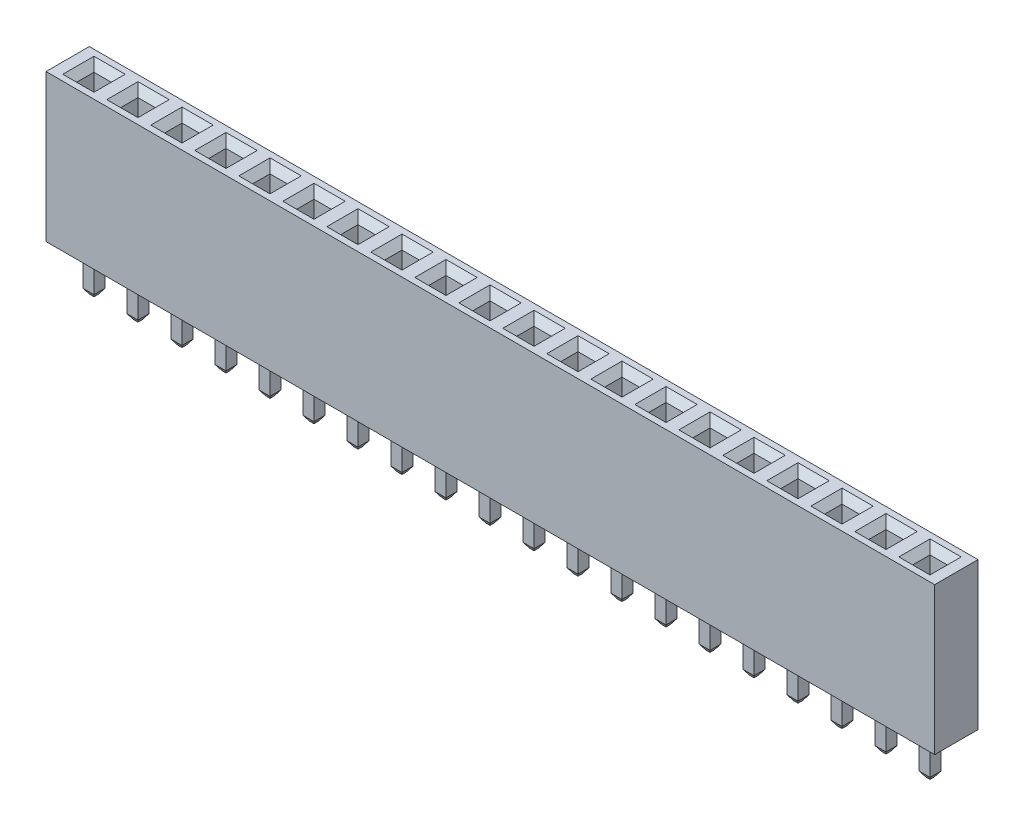
from build123d import *
from OCP.BRepFilletAPI import BRepFilletAPI_MakeChamfer

# Parameters (mm, degrees)
SKETCH1_W           = 51.3
SKETCH1_H           = 2.5
BOSS_EXTRUDE1_DEPTH = 8.5
SKETCH2_W           = 0.64
SKETCH2_H           = 0.64
BOSS_EXTRUDE2_DEPTH = 2.5
CHAMFER1_SIZE       = 0.3
CHAMFER1_SIZE2      = 0.194822278
SKETCH3_W           = 1
SKETCH3_H           = 1
CUT_EXTRUDE1_DEPTH  = 6
CHAMFER2_SIZE       = 0.4


with BuildPart() as part:
    # Sketch1 → Boss-Extrude1 (new body)
    with BuildSketch(Plane(origin=(0, 0, 0), x_dir=(1, 0, 0), z_dir=(0, 1, 0))):
        with Locations((25.65, 1.25)):
            Rectangle(SKETCH1_W, SKETCH1_H)
    extrude(amount=BOSS_EXTRUDE1_DEPTH)

    # Sketch2 → Boss-Extrude2 (add)
    with BuildSketch(Plane.XZ):
        with Locations((1.52, -1.25)):
            Rectangle(SKETCH2_W, SKETCH2_H)
        with Locations((4.06, -1.25)):
            Rectangle(SKETCH2_W, SKETCH2_H)
        with Locations((6.6, -1.25)):
            Rectangle(SKETCH2_W, SKETCH2_H)
        with Locations((9.14, -1.25)):
            Rectangle(SKETCH2_W, SKETCH2_H)
        with Locations((11.68, -1.25)):
            Rectangle(SKETCH2_W, SKETCH2_H)
        with Locations((14.22, -1.25)):
            Rectangle(SKETCH2_W, SKETCH2_H)
        with Locations((16.76, -1.25)):
            Rectangle(SKETCH2_W, SKETCH2_H)
        with Locations((19.3, -1.25)):
            Rectangle(SKETCH2_W, SKETCH2_H)
        with Locations((21.84, -1.25)):
            Rectangle(SKETCH2_W, SKETCH2_H)
        with Locations((24.38, -1.25)):
            Rectangle(SKETCH2_W, SKETCH2_H)
        with Locations((26.92, -1.25)):
            Rectangle(SKETCH2_W, SKETCH2_H)
        with Locations((29.46, -1.25)):
            Rectangle(SKETCH2_W, SKETCH2_H)
        with Locations((32, -1.25)):
            Rectangle(SKETCH2_W, SKETCH2_H)
        with Locations((34.54, -1.25)):
            Rectangle(SKETCH2_W, SKETCH2_H)
        with Locations((37.08, -1.25)):
            Rectangle(SKETCH2_W, SKETCH2_H)
        with Locations((39.62, -1.25)):
            Rectangle(SKETCH2_W, SKETCH2_H)
        with Locations((42.16, -1.25)):
            Rectangle(SKETCH2_W, SKETCH2_H)
        with Locations((44.7, -1.25)):
            Rectangle(SKETCH2_W, SKETCH2_H)
        with Locations((47.24, -1.25)):
            Rectangle(SKETCH2_W, SKETCH2_H)
        with Locations((49.78, -1.25)):
            Rectangle(SKETCH2_W, SKETCH2_H)
    extrude(amount=BOSS_EXTRUDE2_DEPTH)

    # Chamfer1: one chamfer whose edges measure the first distance from different faces: ONE call of the kernel's chamfer builder (chamfer() names one face for all edges)
    chamfer1_edges_1 = [part.edges().sort_by_distance(p)[0] for p in [
        (21.52, -2.5, -1.25),
    ]]
    chamfer1_side_1 = [part.faces().sort_by_distance(p)[0] for p in [
        (21.52, -1.25, -1.25),
    ]]
    chamfer1_edges_2 = [part.edges().sort_by_distance(p)[0] for p in [
        (21.84, -2.5, -1.57),
    ]]
    chamfer1_side_2 = [part.faces().sort_by_distance(p)[0] for p in [
        (21.84, -1.25, -1.57),
    ]]
    chamfer1_edges_3 = [part.edges().sort_by_distance(p)[0] for p in [
        (22.16, -2.5, -1.25),
    ]]
    chamfer1_side_3 = [part.faces().sort_by_distance(p)[0] for p in [
        (22.16, -1.25, -1.25),
    ]]
    chamfer1_edges_4 = [part.edges().sort_by_distance(p)[0] for p in [
        (21.84, -2.5, -0.93),
    ]]
    chamfer1_side_4 = [part.faces().sort_by_distance(p)[0] for p in [
        (21.84, -1.25, -0.93),
    ]]
    chamfer1_edges_5 = [part.edges().sort_by_distance(p)[0] for p in [
        (24.06, -2.5, -1.25),
    ]]
    chamfer1_side_5 = [part.faces().sort_by_distance(p)[0] for p in [
        (24.06, -1.25, -1.25),
    ]]
    chamfer1_edges_6 = [part.edges().sort_by_distance(p)[0] for p in [
        (24.38, -2.5, -1.57),
    ]]
    chamfer1_side_6 = [part.faces().sort_by_distance(p)[0] for p in [
        (24.38, -1.25, -1.57),
    ]]
    chamfer1_edges_7 = [part.edges().sort_by_distance(p)[0] for p in [
        (24.7, -2.5, -1.25),
    ]]
    chamfer1_side_7 = [part.faces().sort_by_distance(p)[0] for p in [
        (24.7, -1.25, -1.25),
    ]]
    chamfer1_edges_8 = [part.edges().sort_by_distance(p)[0] for p in [
        (24.38, -2.5, -0.93),
    ]]
    chamfer1_side_8 = [part.faces().sort_by_distance(p)[0] for p in [
        (24.38, -1.25, -0.93),
    ]]
    chamfer1_edges_9 = [part.edges().sort_by_distance(p)[0] for p in [
        (26.6, -2.5, -1.25),
    ]]
    chamfer1_side_9 = [part.faces().sort_by_distance(p)[0] for p in [
        (26.6, -1.25, -1.25),
    ]]
    chamfer1_edges_10 = [part.edges().sort_by_distance(p)[0] for p in [
        (26.92, -2.5, -1.57),
    ]]
    chamfer1_side_10 = [part.faces().sort_by_distance(p)[0] for p in [
        (26.92, -1.25, -1.57),
    ]]
    chamfer1_edges_11 = [part.edges().sort_by_distance(p)[0] for p in [
        (27.24, -2.5, -1.25),
    ]]
    chamfer1_side_11 = [part.faces().sort_by_distance(p)[0] for p in [
        (27.24, -1.25, -1.25),
    ]]
    chamfer1_edges_12 = [part.edges().sort_by_distance(p)[0] for p in [
        (26.92, -2.5, -0.93),
    ]]
    chamfer1_side_12 = [part.faces().sort_by_distance(p)[0] for p in [
        (26.92, -1.25, -0.93),
    ]]
    chamfer1_edges_13 = [part.edges().sort_by_distance(p)[0] for p in [
        (29.14, -2.5, -1.25),
    ]]
    chamfer1_side_13 = [part.faces().sort_by_distance(p)[0] for p in [
        (29.14, -1.25, -1.25),
    ]]
    chamfer1_edges_14 = [part.edges().sort_by_distance(p)[0] for p in [
        (29.46, -2.5, -1.57),
    ]]
    chamfer1_side_14 = [part.faces().sort_by_distance(p)[0] for p in [
        (29.46, -1.25, -1.57),
    ]]
    chamfer1_edges_15 = [part.edges().sort_by_distance(p)[0] for p in [
        (29.78, -2.5, -1.25),
    ]]
    chamfer1_side_15 = [part.faces().sort_by_distance(p)[0] for p in [
        (29.78, -1.25, -1.25),
    ]]
    chamfer1_edges_16 = [part.edges().sort_by_distance(p)[0] for p in [
        (29.46, -2.5, -0.93),
    ]]
    chamfer1_side_16 = [part.faces().sort_by_distance(p)[0] for p in [
        (29.46, -1.25, -0.93),
    ]]
    chamfer1_edges_17 = [part.edges().sort_by_distance(p)[0] for p in [
        (31.68, -2.5, -1.25),
    ]]
    chamfer1_side_17 = [part.faces().sort_by_distance(p)[0] for p in [
        (31.68, -1.25, -1.25),
    ]]
    chamfer1_edges_18 = [part.edges().sort_by_distance(p)[0] for p in [
        (32, -2.5, -1.57),
    ]]
    chamfer1_side_18 = [part.faces().sort_by_distance(p)[0] for p in [
        (32, -1.25, -1.57),
    ]]
    chamfer1_edges_19 = [part.edges().sort_by_distance(p)[0] for p in [
        (32.32, -2.5, -1.25),
    ]]
    chamfer1_side_19 = [part.faces().sort_by_distance(p)[0] for p in [
        (32.32, -1.25, -1.25),
    ]]
    chamfer1_edges_20 = [part.edges().sort_by_distance(p)[0] for p in [
        (32, -2.5, -0.93),
    ]]
    chamfer1_side_20 = [part.faces().sort_by_distance(p)[0] for p in [
        (32, -1.25, -0.93),
    ]]
    chamfer1_edges_21 = [part.edges().sort_by_distance(p)[0] for p in [
        (34.22, -2.5, -1.25),
    ]]
    chamfer1_side_21 = [part.faces().sort_by_distance(p)[0] for p in [
        (34.22, -1.25, -1.25),
    ]]
    chamfer1_edges_22 = [part.edges().sort_by_distance(p)[0] for p in [
        (34.54, -2.5, -1.57),
    ]]
    chamfer1_side_22 = [part.faces().sort_by_distance(p)[0] for p in [
        (34.54, -1.25, -1.57),
    ]]
    chamfer1_edges_23 = [part.edges().sort_by_distance(p)[0] for p in [
        (34.86, -2.5, -1.25),
    ]]
    chamfer1_side_23 = [part.faces().sort_by_distance(p)[0] for p in [
        (34.86, -1.25, -1.25),
    ]]
    chamfer1_edges_24 = [part.edges().sort_by_distance(p)[0] for p in [
        (34.54, -2.5, -0.93),
    ]]
    chamfer1_side_24 = [part.faces().sort_by_distance(p)[0] for p in [
        (34.54, -1.25, -0.93),
    ]]
    chamfer1_edges_25 = [part.edges().sort_by_distance(p)[0] for p in [
        (36.76, -2.5, -1.25),
    ]]
    chamfer1_side_25 = [part.faces().sort_by_distance(p)[0] for p in [
        (36.76, -1.25, -1.25),
    ]]
    chamfer1_edges_26 = [part.edges().sort_by_distance(p)[0] for p in [
        (37.08, -2.5, -1.57),
    ]]
    chamfer1_side_26 = [part.faces().sort_by_distance(p)[0] for p in [
        (37.08, -1.25, -1.57),
    ]]
    chamfer1_edges_27 = [part.edges().sort_by_distance(p)[0] for p in [
        (37.4, -2.5, -1.25),
    ]]
    chamfer1_side_27 = [part.faces().sort_by_distance(p)[0] for p in [
        (37.4, -1.25, -1.25),
    ]]
    chamfer1_edges_28 = [part.edges().sort_by_distance(p)[0] for p in [
        (37.08, -2.5, -0.93),
    ]]
    chamfer1_side_28 = [part.faces().sort_by_distance(p)[0] for p in [
        (37.08, -1.25, -0.93),
    ]]
    chamfer1_edges_29 = [part.edges().sort_by_distance(p)[0] for p in [
        (1.2, -2.5, -1.25),
    ]]
    chamfer1_side_29 = [part.faces().sort_by_distance(p)[0] for p in [
        (1.2, -1.25, -1.25),
    ]]
    chamfer1_edges_30 = [part.edges().sort_by_distance(p)[0] for p in [
        (1.52, -2.5, -1.57),
    ]]
    chamfer1_side_30 = [part.faces().sort_by_distance(p)[0] for p in [
        (1.52, -1.25, -1.57),
    ]]
    chamfer1_edges_31 = [part.edges().sort_by_distance(p)[0] for p in [
        (1.84, -2.5, -1.25),
    ]]
    chamfer1_side_31 = [part.faces().sort_by_distance(p)[0] for p in [
        (1.84, -1.25, -1.25),
    ]]
    chamfer1_edges_32 = [part.edges().sort_by_distance(p)[0] for p in [
        (39.3, -2.5, -1.25),
    ]]
    chamfer1_side_32 = [part.faces().sort_by_distance(p)[0] for p in [
        (39.3, -1.25, -1.25),
    ]]
    chamfer1_edges_33 = [part.edges().sort_by_distance(p)[0] for p in [
        (39.62, -2.5, -1.57),
    ]]
    chamfer1_side_33 = [part.faces().sort_by_distance(p)[0] for p in [
        (39.62, -1.25, -1.57),
    ]]
    chamfer1_edges_34 = [part.edges().sort_by_distance(p)[0] for p in [
        (39.94, -2.5, -1.25),
    ]]
    chamfer1_side_34 = [part.faces().sort_by_distance(p)[0] for p in [
        (39.94, -1.25, -1.25),
    ]]
    chamfer1_edges_35 = [part.edges().sort_by_distance(p)[0] for p in [
        (39.62, -2.5, -0.93),
    ]]
    chamfer1_side_35 = [part.faces().sort_by_distance(p)[0] for p in [
        (39.62, -1.25, -0.93),
    ]]
    chamfer1_edges_36 = [part.edges().sort_by_distance(p)[0] for p in [
        (1.52, -2.5, -0.93),
    ]]
    chamfer1_side_36 = [part.faces().sort_by_distance(p)[0] for p in [
        (1.52, -1.25, -0.93),
    ]]
    chamfer1_edges_37 = [part.edges().sort_by_distance(p)[0] for p in [
        (41.84, -2.5, -1.25),
    ]]
    chamfer1_side_37 = [part.faces().sort_by_distance(p)[0] for p in [
        (41.84, -1.25, -1.25),
    ]]
    chamfer1_edges_38 = [part.edges().sort_by_distance(p)[0] for p in [
        (42.16, -2.5, -1.57),
    ]]
    chamfer1_side_38 = [part.faces().sort_by_distance(p)[0] for p in [
        (42.16, -1.25, -1.57),
    ]]
    chamfer1_edges_39 = [part.edges().sort_by_distance(p)[0] for p in [
        (42.48, -2.5, -1.25),
    ]]
    chamfer1_side_39 = [part.faces().sort_by_distance(p)[0] for p in [
        (42.48, -1.25, -1.25),
    ]]
    chamfer1_edges_40 = [part.edges().sort_by_distance(p)[0] for p in [
        (42.16, -2.5, -0.93),
    ]]
    chamfer1_side_40 = [part.faces().sort_by_distance(p)[0] for p in [
        (42.16, -1.25, -0.93),
    ]]
    chamfer1_edges_41 = [part.edges().sort_by_distance(p)[0] for p in [
        (44.38, -2.5, -1.25),
    ]]
    chamfer1_side_41 = [part.faces().sort_by_distance(p)[0] for p in [
        (44.38, -1.25, -1.25),
    ]]
    chamfer1_edges_42 = [part.edges().sort_by_distance(p)[0] for p in [
        (44.7, -2.5, -1.57),
    ]]
    chamfer1_side_42 = [part.faces().sort_by_distance(p)[0] for p in [
        (44.7, -1.25, -1.57),
    ]]
    chamfer1_edges_43 = [part.edges().sort_by_distance(p)[0] for p in [
        (45.02, -2.5, -1.25),
    ]]
    chamfer1_side_43 = [part.faces().sort_by_distance(p)[0] for p in [
        (45.02, -1.25, -1.25),
    ]]
    chamfer1_edges_44 = [part.edges().sort_by_distance(p)[0] for p in [
        (44.7, -2.5, -0.93),
    ]]
    chamfer1_side_44 = [part.faces().sort_by_distance(p)[0] for p in [
        (44.7, -1.25, -0.93),
    ]]
    chamfer1_edges_45 = [part.edges().sort_by_distance(p)[0] for p in [
        (46.92, -2.5, -1.25),
    ]]
    chamfer1_side_45 = [part.faces().sort_by_distance(p)[0] for p in [
        (46.92, -1.25, -1.25),
    ]]
    chamfer1_edges_46 = [part.edges().sort_by_distance(p)[0] for p in [
        (47.24, -2.5, -1.57),
    ]]
    chamfer1_side_46 = [part.faces().sort_by_distance(p)[0] for p in [
        (47.24, -1.25, -1.57),
    ]]
    chamfer1_edges_47 = [part.edges().sort_by_distance(p)[0] for p in [
        (47.56, -2.5, -1.25),
    ]]
    chamfer1_side_47 = [part.faces().sort_by_distance(p)[0] for p in [
        (47.56, -1.25, -1.25),
    ]]
    chamfer1_edges_48 = [part.edges().sort_by_distance(p)[0] for p in [
        (47.24, -2.5, -0.93),
    ]]
    chamfer1_side_48 = [part.faces().sort_by_distance(p)[0] for p in [
        (47.24, -1.25, -0.93),
    ]]
    chamfer1_edges_49 = [part.edges().sort_by_distance(p)[0] for p in [
        (49.46, -2.5, -1.25),
    ]]
    chamfer1_side_49 = [part.faces().sort_by_distance(p)[0] for p in [
        (49.46, -1.25, -1.25),
    ]]
    chamfer1_edges_50 = [part.edges().sort_by_distance(p)[0] for p in [
        (49.78, -2.5, -1.57),
    ]]
    chamfer1_side_50 = [part.faces().sort_by_distance(p)[0] for p in [
        (49.78, -1.25, -1.57),
    ]]
    chamfer1_edges_51 = [part.edges().sort_by_distance(p)[0] for p in [
        (50.1, -2.5, -1.25),
    ]]
    chamfer1_side_51 = [part.faces().sort_by_distance(p)[0] for p in [
        (50.1, -1.25, -1.25),
    ]]
    chamfer1_edges_52 = [part.edges().sort_by_distance(p)[0] for p in [
        (49.78, -2.5, -0.93),
    ]]
    chamfer1_side_52 = [part.faces().sort_by_distance(p)[0] for p in [
        (49.78, -1.25, -0.93),
    ]]
    chamfer1_edges_53 = [part.edges().sort_by_distance(p)[0] for p in [
        (3.74, -2.5, -1.25),
    ]]
    chamfer1_side_53 = [part.faces().sort_by_distance(p)[0] for p in [
        (3.74, -1.25, -1.25),
    ]]
    chamfer1_edges_54 = [part.edges().sort_by_distance(p)[0] for p in [
        (4.06, -2.5, -1.57),
    ]]
    chamfer1_side_54 = [part.faces().sort_by_distance(p)[0] for p in [
        (4.06, -1.25, -1.57),
    ]]
    chamfer1_edges_55 = [part.edges().sort_by_distance(p)[0] for p in [
        (4.38, -2.5, -1.25),
    ]]
    chamfer1_side_55 = [part.faces().sort_by_distance(p)[0] for p in [
        (4.38, -1.25, -1.25),
    ]]
    chamfer1_edges_56 = [part.edges().sort_by_distance(p)[0] for p in [
        (4.06, -2.5, -0.93),
    ]]
    chamfer1_side_56 = [part.faces().sort_by_distance(p)[0] for p in [
        (4.06, -1.25, -0.93),
    ]]
    chamfer1_edges_57 = [part.edges().sort_by_distance(p)[0] for p in [
        (6.28, -2.5, -1.25),
    ]]
    chamfer1_side_57 = [part.faces().sort_by_distance(p)[0] for p in [
        (6.28, -1.25, -1.25),
    ]]
    chamfer1_edges_58 = [part.edges().sort_by_distance(p)[0] for p in [
        (6.6, -2.5, -1.57),
    ]]
    chamfer1_side_58 = [part.faces().sort_by_distance(p)[0] for p in [
        (6.6, -1.25, -1.57),
    ]]
    chamfer1_edges_59 = [part.edges().sort_by_distance(p)[0] for p in [
        (6.92, -2.5, -1.25),
    ]]
    chamfer1_side_59 = [part.faces().sort_by_distance(p)[0] for p in [
        (6.92, -1.25, -1.25),
    ]]
    chamfer1_edges_60 = [part.edges().sort_by_distance(p)[0] for p in [
        (6.6, -2.5, -0.93),
    ]]
    chamfer1_side_60 = [part.faces().sort_by_distance(p)[0] for p in [
        (6.6, -1.25, -0.93),
    ]]
    chamfer1_edges_61 = [part.edges().sort_by_distance(p)[0] for p in [
        (8.82, -2.5, -1.25),
    ]]
    chamfer1_side_61 = [part.faces().sort_by_distance(p)[0] for p in [
        (8.82, -1.25, -1.25),
    ]]
    chamfer1_edges_62 = [part.edges().sort_by_distance(p)[0] for p in [
        (9.14, -2.5, -1.57),
    ]]
    chamfer1_side_62 = [part.faces().sort_by_distance(p)[0] for p in [
        (9.14, -1.25, -1.57),
    ]]
    chamfer1_edges_63 = [part.edges().sort_by_distance(p)[0] for p in [
        (9.46, -2.5, -1.25),
    ]]
    chamfer1_side_63 = [part.faces().sort_by_distance(p)[0] for p in [
        (9.46, -1.25, -1.25),
    ]]
    chamfer1_edges_64 = [part.edges().sort_by_distance(p)[0] for p in [
        (9.14, -2.5, -0.93),
    ]]
    chamfer1_side_64 = [part.faces().sort_by_distance(p)[0] for p in [
        (9.14, -1.25, -0.93),
    ]]
    chamfer1_edges_65 = [part.edges().sort_by_distance(p)[0] for p in [
        (11.36, -2.5, -1.25),
    ]]
    chamfer1_side_65 = [part.faces().sort_by_distance(p)[0] for p in [
        (11.36, -1.25, -1.25),
    ]]
    chamfer1_edges_66 = [part.edges().sort_by_distance(p)[0] for p in [
        (11.68, -2.5, -1.57),
    ]]
    chamfer1_side_66 = [part.faces().sort_by_distance(p)[0] for p in [
        (11.68, -1.25, -1.57),
    ]]
    chamfer1_edges_67 = [part.edges().sort_by_distance(p)[0] for p in [
        (12, -2.5, -1.25),
    ]]
    chamfer1_side_67 = [part.faces().sort_by_distance(p)[0] for p in [
        (12, -1.25, -1.25),
    ]]
    chamfer1_edges_68 = [part.edges().sort_by_distance(p)[0] for p in [
        (11.68, -2.5, -0.93),
    ]]
    chamfer1_side_68 = [part.faces().sort_by_distance(p)[0] for p in [
        (11.68, -1.25, -0.93),
    ]]
    chamfer1_edges_69 = [part.edges().sort_by_distance(p)[0] for p in [
        (13.9, -2.5, -1.25),
    ]]
    chamfer1_side_69 = [part.faces().sort_by_distance(p)[0] for p in [
        (13.9, -1.25, -1.25),
    ]]
    chamfer1_edges_70 = [part.edges().sort_by_distance(p)[0] for p in [
        (14.22, -2.5, -1.57),
    ]]
    chamfer1_side_70 = [part.faces().sort_by_distance(p)[0] for p in [
        (14.22, -1.25, -1.57),
    ]]
    chamfer1_edges_71 = [part.edges().sort_by_distance(p)[0] for p in [
        (14.54, -2.5, -1.25),
    ]]
    chamfer1_side_71 = [part.faces().sort_by_distance(p)[0] for p in [
        (14.54, -1.25, -1.25),
    ]]
    chamfer1_edges_72 = [part.edges().sort_by_distance(p)[0] for p in [
        (14.22, -2.5, -0.93),
    ]]
    chamfer1_side_72 = [part.faces().sort_by_distance(p)[0] for p in [
        (14.22, -1.25, -0.93),
    ]]
    chamfer1_edges_73 = [part.edges().sort_by_distance(p)[0] for p in [
        (16.44, -2.5, -1.25),
    ]]
    chamfer1_side_73 = [part.faces().sort_by_distance(p)[0] for p in [
        (16.44, -1.25, -1.25),
    ]]
    chamfer1_edges_74 = [part.edges().sort_by_distance(p)[0] for p in [
        (16.76, -2.5, -1.57),
    ]]
    chamfer1_side_74 = [part.faces().sort_by_distance(p)[0] for p in [
        (16.76, -1.25, -1.57),
    ]]
    chamfer1_edges_75 = [part.edges().sort_by_distance(p)[0] for p in [
        (17.08, -2.5, -1.25),
    ]]
    chamfer1_side_75 = [part.faces().sort_by_distance(p)[0] for p in [
        (17.08, -1.25, -1.25),
    ]]
    chamfer1_edges_76 = [part.edges().sort_by_distance(p)[0] for p in [
        (16.76, -2.5, -0.93),
    ]]
    chamfer1_side_76 = [part.faces().sort_by_distance(p)[0] for p in [
        (16.76, -1.25, -0.93),
    ]]
    chamfer1_edges_77 = [part.edges().sort_by_distance(p)[0] for p in [
        (18.98, -2.5, -1.25),
    ]]
    chamfer1_side_77 = [part.faces().sort_by_distance(p)[0] for p in [
        (18.98, -1.25, -1.25),
    ]]
    chamfer1_edges_78 = [part.edges().sort_by_distance(p)[0] for p in [
        (19.3, -2.5, -1.57),
    ]]
    chamfer1_side_78 = [part.faces().sort_by_distance(p)[0] for p in [
        (19.3, -1.25, -1.57),
    ]]
    chamfer1_edges_79 = [part.edges().sort_by_distance(p)[0] for p in [
        (19.62, -2.5, -1.25),
    ]]
    chamfer1_side_79 = [part.faces().sort_by_distance(p)[0] for p in [
        (19.62, -1.25, -1.25),
    ]]
    chamfer1_edges_80 = [part.edges().sort_by_distance(p)[0] for p in [
        (19.3, -2.5, -0.93),
    ]]
    chamfer1_side_80 = [part.faces().sort_by_distance(p)[0] for p in [
        (19.3, -1.25, -0.93),
    ]]
    chamfer1 = BRepFilletAPI_MakeChamfer(part.part.solid().wrapped)
    for e in chamfer1_edges_1:
        chamfer1.Add(CHAMFER1_SIZE, CHAMFER1_SIZE2, e.wrapped, chamfer1_side_1[0].wrapped)  # the first distance lies on this face
    for e in chamfer1_edges_2:
        chamfer1.Add(CHAMFER1_SIZE, CHAMFER1_SIZE2, e.wrapped, chamfer1_side_2[0].wrapped)  # the first distance lies on this face
    for e in chamfer1_edges_3:
        chamfer1.Add(CHAMFER1_SIZE, CHAMFER1_SIZE2, e.wrapped, chamfer1_side_3[0].wrapped)  # the first distance lies on this face
    for e in chamfer1_edges_4:
        chamfer1.Add(CHAMFER1_SIZE, CHAMFER1_SIZE2, e.wrapped, chamfer1_side_4[0].wrapped)  # the first distance lies on this face
    for e in chamfer1_edges_5:
        chamfer1.Add(CHAMFER1_SIZE, CHAMFER1_SIZE2, e.wrapped, chamfer1_side_5[0].wrapped)  # the first distance lies on this face
    for e in chamfer1_edges_6:
        chamfer1.Add(CHAMFER1_SIZE, CHAMFER1_SIZE2, e.wrapped, chamfer1_side_6[0].wrapped)  # the first distance lies on this face
    for e in chamfer1_edges_7:
        chamfer1.Add(CHAMFER1_SIZE, CHAMFER1_SIZE2, e.wrapped, chamfer1_side_7[0].wrapped)  # the first distance lies on this face
    for e in chamfer1_edges_8:
        chamfer1.Add(CHAMFER1_SIZE, CHAMFER1_SIZE2, e.wrapped, chamfer1_side_8[0].wrapped)  # the first distance lies on this face
    for e in chamfer1_edges_9:
        chamfer1.Add(CHAMFER1_SIZE, CHAMFER1_SIZE2, e.wrapped, chamfer1_side_9[0].wrapped)  # the first distance lies on this face
    for e in chamfer1_edges_10:
        chamfer1.Add(CHAMFER1_SIZE, CHAMFER1_SIZE2, e.wrapped, chamfer1_side_10[0].wrapped)  # the first distance lies on this face
    for e in chamfer1_edges_11:
        chamfer1.Add(CHAMFER1_SIZE, CHAMFER1_SIZE2, e.wrapped, chamfer1_side_11[0].wrapped)  # the first distance lies on this face
    for e in chamfer1_edges_12:
        chamfer1.Add(CHAMFER1_SIZE, CHAMFER1_SIZE2, e.wrapped, chamfer1_side_12[0].wrapped)  # the first distance lies on this face
    for e in chamfer1_edges_13:
        chamfer1.Add(CHAMFER1_SIZE, CHAMFER1_SIZE2, e.wrapped, chamfer1_side_13[0].wrapped)  # the first distance lies on this face
    for e in chamfer1_edges_14:
        chamfer1.Add(CHAMFER1_SIZE, CHAMFER1_SIZE2, e.wrapped, chamfer1_side_14[0].wrapped)  # the first distance lies on this face
    for e in chamfer1_edges_15:
        chamfer1.Add(CHAMFER1_SIZE, CHAMFER1_SIZE2, e.wrapped, chamfer1_side_15[0].wrapped)  # the first distance lies on this face
    for e in chamfer1_edges_16:
        chamfer1.Add(CHAMFER1_SIZE, CHAMFER1_SIZE2, e.wrapped, chamfer1_side_16[0].wrapped)  # the first distance lies on this face
    for e in chamfer1_edges_17:
        chamfer1.Add(CHAMFER1_SIZE, CHAMFER1_SIZE2, e.wrapped, chamfer1_side_17[0].wrapped)  # the first distance lies on this face
    for e in chamfer1_edges_18:
        chamfer1.Add(CHAMFER1_SIZE, CHAMFER1_SIZE2, e.wrapped, chamfer1_side_18[0].wrapped)  # the first distance lies on this face
    for e in chamfer1_edges_19:
        chamfer1.Add(CHAMFER1_SIZE, CHAMFER1_SIZE2, e.wrapped, chamfer1_side_19[0].wrapped)  # the first distance lies on this face
    for e in chamfer1_edges_20:
        chamfer1.Add(CHAMFER1_SIZE, CHAMFER1_SIZE2, e.wrapped, chamfer1_side_20[0].wrapped)  # the first distance lies on this face
    for e in chamfer1_edges_21:
        chamfer1.Add(CHAMFER1_SIZE, CHAMFER1_SIZE2, e.wrapped, chamfer1_side_21[0].wrapped)  # the first distance lies on this face
    for e in chamfer1_edges_22:
        chamfer1.Add(CHAMFER1_SIZE, CHAMFER1_SIZE2, e.wrapped, chamfer1_side_22[0].wrapped)  # the first distance lies on this face
    for e in chamfer1_edges_23:
        chamfer1.Add(CHAMFER1_SIZE, CHAMFER1_SIZE2, e.wrapped, chamfer1_side_23[0].wrapped)  # the first distance lies on this face
    for e in chamfer1_edges_24:
        chamfer1.Add(CHAMFER1_SIZE, CHAMFER1_SIZE2, e.wrapped, chamfer1_side_24[0].wrapped)  # the first distance lies on this face
    for e in chamfer1_edges_25:
        chamfer1.Add(CHAMFER1_SIZE, CHAMFER1_SIZE2, e.wrapped, chamfer1_side_25[0].wrapped)  # the first distance lies on this face
    for e in chamfer1_edges_26:
        chamfer1.Add(CHAMFER1_SIZE, CHAMFER1_SIZE2, e.wrapped, chamfer1_side_26[0].wrapped)  # the first distance lies on this face
    for e in chamfer1_edges_27:
        chamfer1.Add(CHAMFER1_SIZE, CHAMFER1_SIZE2, e.wrapped, chamfer1_side_27[0].wrapped)  # the first distance lies on this face
    for e in chamfer1_edges_28:
        chamfer1.Add(CHAMFER1_SIZE, CHAMFER1_SIZE2, e.wrapped, chamfer1_side_28[0].wrapped)  # the first distance lies on this face
    for e in chamfer1_edges_29:
        chamfer1.Add(CHAMFER1_SIZE, CHAMFER1_SIZE2, e.wrapped, chamfer1_side_29[0].wrapped)  # the first distance lies on this face
    for e in chamfer1_edges_30:
        chamfer1.Add(CHAMFER1_SIZE, CHAMFER1_SIZE2, e.wrapped, chamfer1_side_30[0].wrapped)  # the first distance lies on this face
    for e in chamfer1_edges_31:
        chamfer1.Add(CHAMFER1_SIZE, CHAMFER1_SIZE2, e.wrapped, chamfer1_side_31[0].wrapped)  # the first distance lies on this face
    for e in chamfer1_edges_32:
        chamfer1.Add(CHAMFER1_SIZE, CHAMFER1_SIZE2, e.wrapped, chamfer1_side_32[0].wrapped)  # the first distance lies on this face
    for e in chamfer1_edges_33:
        chamfer1.Add(CHAMFER1_SIZE, CHAMFER1_SIZE2, e.wrapped, chamfer1_side_33[0].wrapped)  # the first distance lies on this face
    for e in chamfer1_edges_34:
        chamfer1.Add(CHAMFER1_SIZE, CHAMFER1_SIZE2, e.wrapped, chamfer1_side_34[0].wrapped)  # the first distance lies on this face
    for e in chamfer1_edges_35:
        chamfer1.Add(CHAMFER1_SIZE, CHAMFER1_SIZE2, e.wrapped, chamfer1_side_35[0].wrapped)  # the first distance lies on this face
    for e in chamfer1_edges_36:
        chamfer1.Add(CHAMFER1_SIZE, CHAMFER1_SIZE2, e.wrapped, chamfer1_side_36[0].wrapped)  # the first distance lies on this face
    for e in chamfer1_edges_37:
        chamfer1.Add(CHAMFER1_SIZE, CHAMFER1_SIZE2, e.wrapped, chamfer1_side_37[0].wrapped)  # the first distance lies on this face
    for e in chamfer1_edges_38:
        chamfer1.Add(CHAMFER1_SIZE, CHAMFER1_SIZE2, e.wrapped, chamfer1_side_38[0].wrapped)  # the first distance lies on this face
    for e in chamfer1_edges_39:
        chamfer1.Add(CHAMFER1_SIZE, CHAMFER1_SIZE2, e.wrapped, chamfer1_side_39[0].wrapped)  # the first distance lies on this face
    for e in chamfer1_edges_40:
        chamfer1.Add(CHAMFER1_SIZE, CHAMFER1_SIZE2, e.wrapped, chamfer1_side_40[0].wrapped)  # the first distance lies on this face
    for e in chamfer1_edges_41:
        chamfer1.Add(CHAMFER1_SIZE, CHAMFER1_SIZE2, e.wrapped, chamfer1_side_41[0].wrapped)  # the first distance lies on this face
    for e in chamfer1_edges_42:
        chamfer1.Add(CHAMFER1_SIZE, CHAMFER1_SIZE2, e.wrapped, chamfer1_side_42[0].wrapped)  # the first distance lies on this face
    for e in chamfer1_edges_43:
        chamfer1.Add(CHAMFER1_SIZE, CHAMFER1_SIZE2, e.wrapped, chamfer1_side_43[0].wrapped)  # the first distance lies on this face
    for e in chamfer1_edges_44:
        chamfer1.Add(CHAMFER1_SIZE, CHAMFER1_SIZE2, e.wrapped, chamfer1_side_44[0].wrapped)  # the first distance lies on this face
    for e in chamfer1_edges_45:
        chamfer1.Add(CHAMFER1_SIZE, CHAMFER1_SIZE2, e.wrapped, chamfer1_side_45[0].wrapped)  # the first distance lies on this face
    for e in chamfer1_edges_46:
        chamfer1.Add(CHAMFER1_SIZE, CHAMFER1_SIZE2, e.wrapped, chamfer1_side_46[0].wrapped)  # the first distance lies on this face
    for e in chamfer1_edges_47:
        chamfer1.Add(CHAMFER1_SIZE, CHAMFER1_SIZE2, e.wrapped, chamfer1_side_47[0].wrapped)  # the first distance lies on this face
    for e in chamfer1_edges_48:
        chamfer1.Add(CHAMFER1_SIZE, CHAMFER1_SIZE2, e.wrapped, chamfer1_side_48[0].wrapped)  # the first distance lies on this face
    for e in chamfer1_edges_49:
        chamfer1.Add(CHAMFER1_SIZE, CHAMFER1_SIZE2, e.wrapped, chamfer1_side_49[0].wrapped)  # the first distance lies on this face
    for e in chamfer1_edges_50:
        chamfer1.Add(CHAMFER1_SIZE, CHAMFER1_SIZE2, e.wrapped, chamfer1_side_50[0].wrapped)  # the first distance lies on this face
    for e in chamfer1_edges_51:
        chamfer1.Add(CHAMFER1_SIZE, CHAMFER1_SIZE2, e.wrapped, chamfer1_side_51[0].wrapped)  # the first distance lies on this face
    for e in chamfer1_edges_52:
        chamfer1.Add(CHAMFER1_SIZE, CHAMFER1_SIZE2, e.wrapped, chamfer1_side_52[0].wrapped)  # the first distance lies on this face
    for e in chamfer1_edges_53:
        chamfer1.Add(CHAMFER1_SIZE, CHAMFER1_SIZE2, e.wrapped, chamfer1_side_53[0].wrapped)  # the first distance lies on this face
    for e in chamfer1_edges_54:
        chamfer1.Add(CHAMFER1_SIZE, CHAMFER1_SIZE2, e.wrapped, chamfer1_side_54[0].wrapped)  # the first distance lies on this face
    for e in chamfer1_edges_55:
        chamfer1.Add(CHAMFER1_SIZE, CHAMFER1_SIZE2, e.wrapped, chamfer1_side_55[0].wrapped)  # the first distance lies on this face
    for e in chamfer1_edges_56:
        chamfer1.Add(CHAMFER1_SIZE, CHAMFER1_SIZE2, e.wrapped, chamfer1_side_56[0].wrapped)  # the first distance lies on this face
    for e in chamfer1_edges_57:
        chamfer1.Add(CHAMFER1_SIZE, CHAMFER1_SIZE2, e.wrapped, chamfer1_side_57[0].wrapped)  # the first distance lies on this face
    for e in chamfer1_edges_58:
        chamfer1.Add(CHAMFER1_SIZE, CHAMFER1_SIZE2, e.wrapped, chamfer1_side_58[0].wrapped)  # the first distance lies on this face
    for e in chamfer1_edges_59:
        chamfer1.Add(CHAMFER1_SIZE, CHAMFER1_SIZE2, e.wrapped, chamfer1_side_59[0].wrapped)  # the first distance lies on this face
    for e in chamfer1_edges_60:
        chamfer1.Add(CHAMFER1_SIZE, CHAMFER1_SIZE2, e.wrapped, chamfer1_side_60[0].wrapped)  # the first distance lies on this face
    for e in chamfer1_edges_61:
        chamfer1.Add(CHAMFER1_SIZE, CHAMFER1_SIZE2, e.wrapped, chamfer1_side_61[0].wrapped)  # the first distance lies on this face
    for e in chamfer1_edges_62:
        chamfer1.Add(CHAMFER1_SIZE, CHAMFER1_SIZE2, e.wrapped, chamfer1_side_62[0].wrapped)  # the first distance lies on this face
    for e in chamfer1_edges_63:
        chamfer1.Add(CHAMFER1_SIZE, CHAMFER1_SIZE2, e.wrapped, chamfer1_side_63[0].wrapped)  # the first distance lies on this face
    for e in chamfer1_edges_64:
        chamfer1.Add(CHAMFER1_SIZE, CHAMFER1_SIZE2, e.wrapped, chamfer1_side_64[0].wrapped)  # the first distance lies on this face
    for e in chamfer1_edges_65:
        chamfer1.Add(CHAMFER1_SIZE, CHAMFER1_SIZE2, e.wrapped, chamfer1_side_65[0].wrapped)  # the first distance lies on this face
    for e in chamfer1_edges_66:
        chamfer1.Add(CHAMFER1_SIZE, CHAMFER1_SIZE2, e.wrapped, chamfer1_side_66[0].wrapped)  # the first distance lies on this face
    for e in chamfer1_edges_67:
        chamfer1.Add(CHAMFER1_SIZE, CHAMFER1_SIZE2, e.wrapped, chamfer1_side_67[0].wrapped)  # the first distance lies on this face
    for e in chamfer1_edges_68:
        chamfer1.Add(CHAMFER1_SIZE, CHAMFER1_SIZE2, e.wrapped, chamfer1_side_68[0].wrapped)  # the first distance lies on this face
    for e in chamfer1_edges_69:
        chamfer1.Add(CHAMFER1_SIZE, CHAMFER1_SIZE2, e.wrapped, chamfer1_side_69[0].wrapped)  # the first distance lies on this face
    for e in chamfer1_edges_70:
        chamfer1.Add(CHAMFER1_SIZE, CHAMFER1_SIZE2, e.wrapped, chamfer1_side_70[0].wrapped)  # the first distance lies on this face
    for e in chamfer1_edges_71:
        chamfer1.Add(CHAMFER1_SIZE, CHAMFER1_SIZE2, e.wrapped, chamfer1_side_71[0].wrapped)  # the first distance lies on this face
    for e in chamfer1_edges_72:
        chamfer1.Add(CHAMFER1_SIZE, CHAMFER1_SIZE2, e.wrapped, chamfer1_side_72[0].wrapped)  # the first distance lies on this face
    for e in chamfer1_edges_73:
        chamfer1.Add(CHAMFER1_SIZE, CHAMFER1_SIZE2, e.wrapped, chamfer1_side_73[0].wrapped)  # the first distance lies on this face
    for e in chamfer1_edges_74:
        chamfer1.Add(CHAMFER1_SIZE, CHAMFER1_SIZE2, e.wrapped, chamfer1_side_74[0].wrapped)  # the first distance lies on this face
    for e in chamfer1_edges_75:
        chamfer1.Add(CHAMFER1_SIZE, CHAMFER1_SIZE2, e.wrapped, chamfer1_side_75[0].wrapped)  # the first distance lies on this face
    for e in chamfer1_edges_76:
        chamfer1.Add(CHAMFER1_SIZE, CHAMFER1_SIZE2, e.wrapped, chamfer1_side_76[0].wrapped)  # the first distance lies on this face
    for e in chamfer1_edges_77:
        chamfer1.Add(CHAMFER1_SIZE, CHAMFER1_SIZE2, e.wrapped, chamfer1_side_77[0].wrapped)  # the first distance lies on this face
    for e in chamfer1_edges_78:
        chamfer1.Add(CHAMFER1_SIZE, CHAMFER1_SIZE2, e.wrapped, chamfer1_side_78[0].wrapped)  # the first distance lies on this face
    for e in chamfer1_edges_79:
        chamfer1.Add(CHAMFER1_SIZE, CHAMFER1_SIZE2, e.wrapped, chamfer1_side_79[0].wrapped)  # the first distance lies on this face
    for e in chamfer1_edges_80:
        chamfer1.Add(CHAMFER1_SIZE, CHAMFER1_SIZE2, e.wrapped, chamfer1_side_80[0].wrapped)  # the first distance lies on this face
    add(Compound.cast(chamfer1.Shape()), mode=Mode.REPLACE)

    # Sketch3 → Cut-Extrude1 (cut)
    with BuildSketch(Plane(origin=(0, 8.5, 0), x_dir=(1, 0, 0), z_dir=(0, 1, 0))):
        with Locations((49.78, 1.25)):
            Rectangle(SKETCH3_W, SKETCH3_H)
        with Locations((47.24, 1.25)):
            Rectangle(SKETCH3_W, SKETCH3_H)
        with Locations((44.7, 1.25)):
            Rectangle(SKETCH3_W, SKETCH3_H)
        with Locations((42.16, 1.25)):
            Rectangle(SKETCH3_W, SKETCH3_H)
        with Locations((39.62, 1.25)):
            Rectangle(SKETCH3_W, SKETCH3_H)
        with Locations((37.08, 1.25)):
            Rectangle(SKETCH3_W, SKETCH3_H)
        with Locations((34.54, 1.25)):
            Rectangle(SKETCH3_W, SKETCH3_H)
        with Locations((32, 1.25)):
            Rectangle(SKETCH3_W, SKETCH3_H)
        with Locations((29.46, 1.25)):
            Rectangle(SKETCH3_W, SKETCH3_H)
        with Locations((26.92, 1.25)):
            Rectangle(SKETCH3_W, SKETCH3_H)
        with Locations((24.38, 1.25)):
            Rectangle(SKETCH3_W, SKETCH3_H)
        with Locations((21.84, 1.25)):
            Rectangle(SKETCH3_W, SKETCH3_H)
        with Locations((19.3, 1.25)):
            Rectangle(SKETCH3_W, SKETCH3_H)
        with Locations((16.76, 1.25)):
            Rectangle(SKETCH3_W, SKETCH3_H)
        with Locations((14.22, 1.25)):
            Rectangle(SKETCH3_W, SKETCH3_H)
        with Locations((11.68, 1.25)):
            Rectangle(SKETCH3_W, SKETCH3_H)
        with Locations((9.14, 1.25)):
            Rectangle(SKETCH3_W, SKETCH3_H)
        with Locations((6.6, 1.25)):
            Rectangle(SKETCH3_W, SKETCH3_H)
        with Locations((4.06, 1.25)):
            Rectangle(SKETCH3_W, SKETCH3_H)
        with Locations((1.52, 1.25)):
            Rectangle(SKETCH3_W, SKETCH3_H)
    extrude(amount=-CUT_EXTRUDE1_DEPTH, mode=Mode.SUBTRACT)

    # Chamfer2
    chamfer2_edges = [part.edges().sort_by_distance(p)[0] for p in [
        (50.28, 8.5, -1.25),
        (49.78, 8.5, -1.75),
        (49.28, 8.5, -1.25),
        (49.78, 8.5, -0.75),
        (47.74, 8.5, -1.25),
        (47.24, 8.5, -1.75),
        (46.74, 8.5, -1.25),
        (47.24, 8.5, -0.75),
        (45.2, 8.5, -1.25),
        (44.7, 8.5, -1.75),
        (44.2, 8.5, -1.25),
        (44.7, 8.5, -0.75),
        (42.66, 8.5, -1.25),
        (42.16, 8.5, -1.75),
        (41.66, 8.5, -1.25),
        (42.16, 8.5, -0.75),
        (40.12, 8.5, -1.25),
        (39.62, 8.5, -1.75),
        (39.12, 8.5, -1.25),
        (39.62, 8.5, -0.75),
        (37.58, 8.5, -1.25),
        (37.08, 8.5, -1.75),
        (36.58, 8.5, -1.25),
        (37.08, 8.5, -0.75),
        (35.04, 8.5, -1.25),
        (34.54, 8.5, -1.75),
        (34.04, 8.5, -1.25),
        (34.54, 8.5, -0.75),
        (32.5, 8.5, -1.25),
        (32, 8.5, -1.75),
        (31.5, 8.5, -1.25),
        (32, 8.5, -0.75),
        (29.96, 8.5, -1.25),
        (29.46, 8.5, -1.75),
        (28.96, 8.5, -1.25),
        (29.46, 8.5, -0.75),
        (27.42, 8.5, -1.25),
        (26.92, 8.5, -1.75),
        (26.42, 8.5, -1.25),
        (26.92, 8.5, -0.75),
        (24.88, 8.5, -1.25),
        (24.38, 8.5, -1.75),
        (23.88, 8.5, -1.25),
        (24.38, 8.5, -0.75),
        (22.34, 8.5, -1.25),
        (21.84, 8.5, -1.75),
        (21.34, 8.5, -1.25),
        (21.84, 8.5, -0.75),
        (19.8, 8.5, -1.25),
        (19.3, 8.5, -1.75),
        (18.8, 8.5, -1.25),
        (19.3, 8.5, -0.75),
        (17.26, 8.5, -1.25),
        (16.76, 8.5, -1.75),
        (16.26, 8.5, -1.25),
        (16.76, 8.5, -0.75),
        (14.72, 8.5, -1.25),
        (14.22, 8.5, -1.75),
        (13.72, 8.5, -1.25),
        (14.22, 8.5, -0.75),
        (12.18, 8.5, -1.25),
        (11.68, 8.5, -1.75),
        (11.18, 8.5, -1.25),
        (11.68, 8.5, -0.75),
        (9.64, 8.5, -1.25),
        (9.14, 8.5, -1.75),
        (8.64, 8.5, -1.25),
        (9.14, 8.5, -0.75),
        (7.1, 8.5, -1.25),
        (6.6, 8.5, -1.75),
        (6.1, 8.5, -1.25),
        (6.6, 8.5, -0.75),
        (4.56, 8.5, -1.25),
        (4.06, 8.5, -1.75),
        (3.56, 8.5, -1.25),
        (4.06, 8.5, -0.75),
        (2.02, 8.5, -1.25),
        (1.52, 8.5, -1.75),
        (1.02, 8.5, -1.25),
        (1.52, 8.5, -0.75),
    ]]
    chamfer(chamfer2_edges, length=CHAMFER2_SIZE)


solid = part.part
